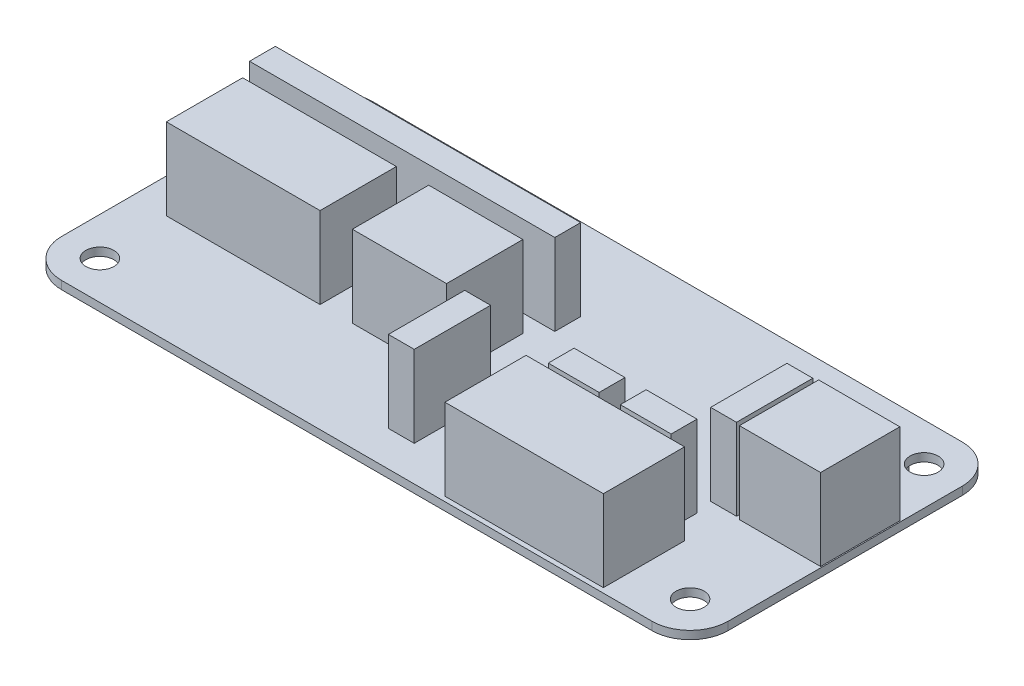
from build123d import *

# Parameters (mm, degrees)
SKETCH1_W           = 65.5
SKETCH1_H           = 30.5
BOSS_EXTRUDE1_DEPTH = 0.8
FILLET1_R           = 3.75
SKETCH2_R           = 1.375
CUT_EXTRUDE1_DEPTH  = 0.8
SKETCH3_W           = 30
SKETCH3_H           = 2.54
SKETCH3_W_2         = 9.253232542
SKETCH3_H_2         = 7.5
SKETCH3_W_3         = 15.108584743
SKETCH3_W_4         = 2.54
SKETCH3_W_5         = 15.573110358
SKETCH3_H_3         = 7.975960023
SKETCH3_W_6         = 5
SKETCH3_W_7         = 7.975960023
SKETCH3_H_4         = 7.78655518
BOSS_EXTRUDE2_DEPTH = 8
SKETCH4_W           = 51
SKETCH4_H           = 4.95
BOSS_EXTRUDE3_DEPTH = 4


with BuildPart() as part:
    # Sketch1 → Boss-Extrude1 (new body)
    with BuildSketch(Plane(origin=(0, 0, 0), x_dir=(1, 0, 0), z_dir=(0, 1, 0))):
        Rectangle(SKETCH1_W, SKETCH1_H)
    extrude(amount=BOSS_EXTRUDE1_DEPTH)

    # Fillet1
    fillet1_edges = [part.edges().sort_by_distance(p)[0] for p in [
        (-32.75, 0.4, -15.25),
        (32.75, 0.4, -15.25),
        (32.75, 0.4, 15.25),
        (-32.75, 0.4, 15.25),
    ]]
    fillet(fillet1_edges, radius=FILLET1_R)

    # Sketch2 → Cut-Extrude1 (cut)
    with BuildSketch(Plane(origin=(0, 0.8, 0), x_dir=(1, 0, 0), z_dir=(0, 1, 0))):
        with Locations(Location((-29, 11.5, 0), (0, 0, 270))):
            Circle(SKETCH2_R)
        with Locations(Location((-29, -11.5, 0), (0, 0, 270))):
            Circle(SKETCH2_R)
        with Locations(Location((29, -11.5, 0), (0, 0, 270))):
            Circle(SKETCH2_R)
        with Locations(Location((29, 11.5, 0), (0, 0, 270))):
            Circle(SKETCH2_R)
    extrude(amount=-CUT_EXTRUDE1_DEPTH, mode=Mode.SUBTRACT)

    # Sketch3 → Boss-Extrude2 (add)
    with BuildSketch(Plane(origin=(0, 0.8, 0), x_dir=(1, 0, 0), z_dir=(0, 1, 0))):
        with Locations((-15.426255017, 5.90276931)):
            Rectangle(SKETCH3_W, SKETCH3_H)
        with Locations((-6.452192743, -0.859199982)):
            Rectangle(SKETCH3_W_2, SKETCH3_H_2)
        with Locations((-21.80689744, -0.859199982)):
            Rectangle(SKETCH3_W_3, SKETCH3_H_2)
        with Locations((0.91413656, -8.040321366)):
            Rectangle(SKETCH3_W_4, SKETCH3_H_2)
        with Locations((15.976005132, -10.794375696)):
            Rectangle(SKETCH3_W_5, SKETCH3_H_3)
        with Locations((22.955137287, 1.585350321)):
            Rectangle(SKETCH3_W_4, SKETCH3_H_2)
        with Locations((12.438021136, -5.10451856)):
            Rectangle(SKETCH3_W_6, SKETCH3_H)
        with Locations((19.513989128, -5.10451856)):
            Rectangle(SKETCH3_W_6, SKETCH3_H)
        with Locations((28.644994423, 1.585350321)):
            Rectangle(SKETCH3_W_7, SKETCH3_H_4)
    extrude(amount=BOSS_EXTRUDE2_DEPTH)

    # Sketch4 → Boss-Extrude3 (add)
    with BuildSketch(Plane.XZ):
        with Locations((-0.25, -11.275)):
            Rectangle(SKETCH4_W, SKETCH4_H)
    extrude(amount=BOSS_EXTRUDE3_DEPTH)


solid = part.part
